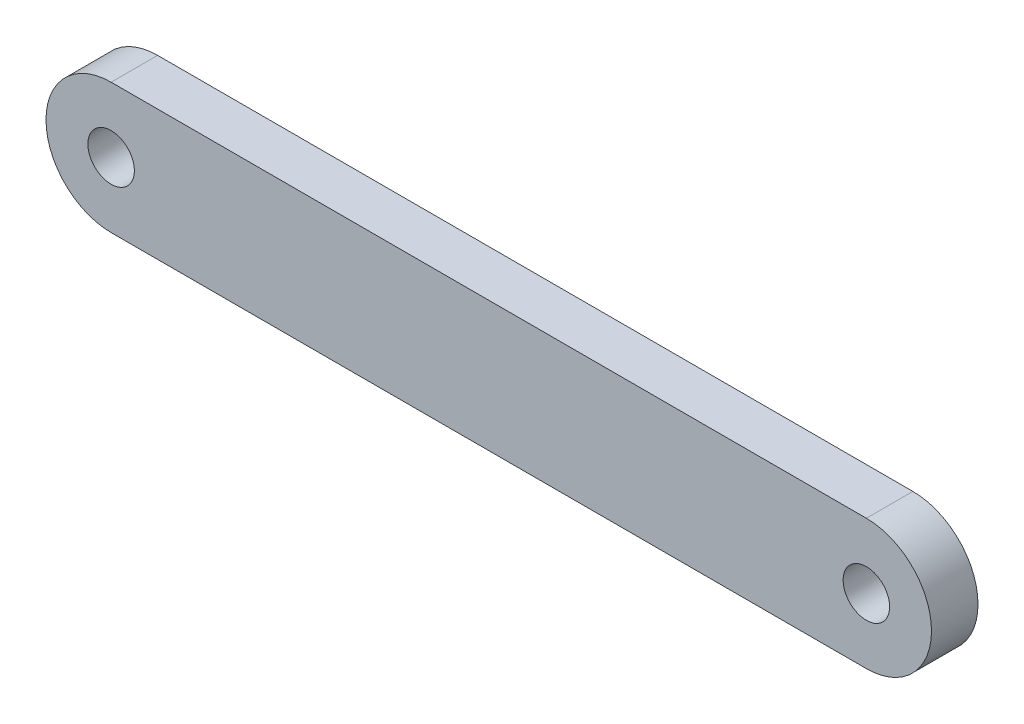
from build123d import *

# Parameters (mm, degrees)
SKETCH1_R           = 3.175
BOSS_EXTRUDE1_DEPTH = 6.35


with BuildPart() as part:
    # Sketch1 → Boss-Extrude1 (new body)
    with BuildSketch(Plane.XY):
        with BuildLine():
            Line((-18.712193521, -8.636495621), (84.386406479, -8.636495621))
            ThreePointArc((84.386406479, -8.636495621), (93.276406479, 0.253504379), (84.386406479, 9.143504379))
            Line((84.386406479, 9.143504379), (-18.712193521, 9.143504379))
            ThreePointArc((-18.712193521, 9.143504379), (-27.602193521, 0.253504379), (-18.712193521, -8.636495621))
        make_face()
        with Locations((-18.712193521, 0.253504379)):
            Circle(SKETCH1_R, mode=Mode.SUBTRACT)
        with Locations((84.386406479, 0.253504379)):
            Circle(SKETCH1_R, mode=Mode.SUBTRACT)
    extrude(amount=BOSS_EXTRUDE1_DEPTH)


solid = part.part
